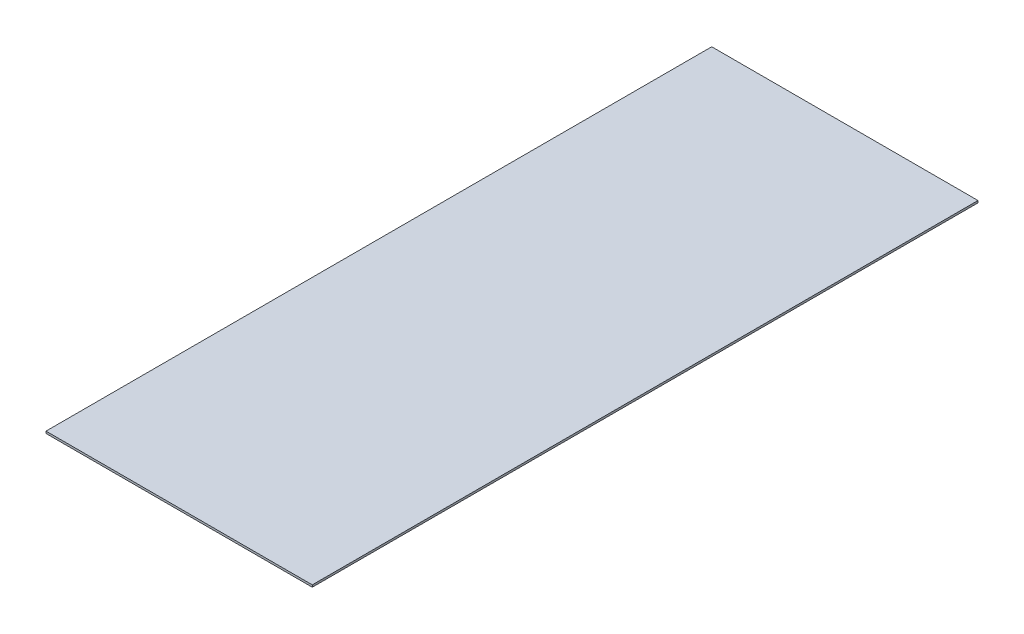
from build123d import *

# Parameters (mm, degrees)
CROQUIS1_W              = 1219.2
CROQUIS1_H              = 3048
SALIENTE_EXTRUIR1_DEPTH = 9.5


with BuildPart() as part:
    # Croquis1 → Saliente-Extruir1 (new body)
    with BuildSketch(Plane(origin=(0, 0, 0), x_dir=(1, 0, 0), z_dir=(0, 1, 0))):
        Rectangle(CROQUIS1_W, CROQUIS1_H)
    extrude(amount=SALIENTE_EXTRUIR1_DEPTH)


solid = part.part
